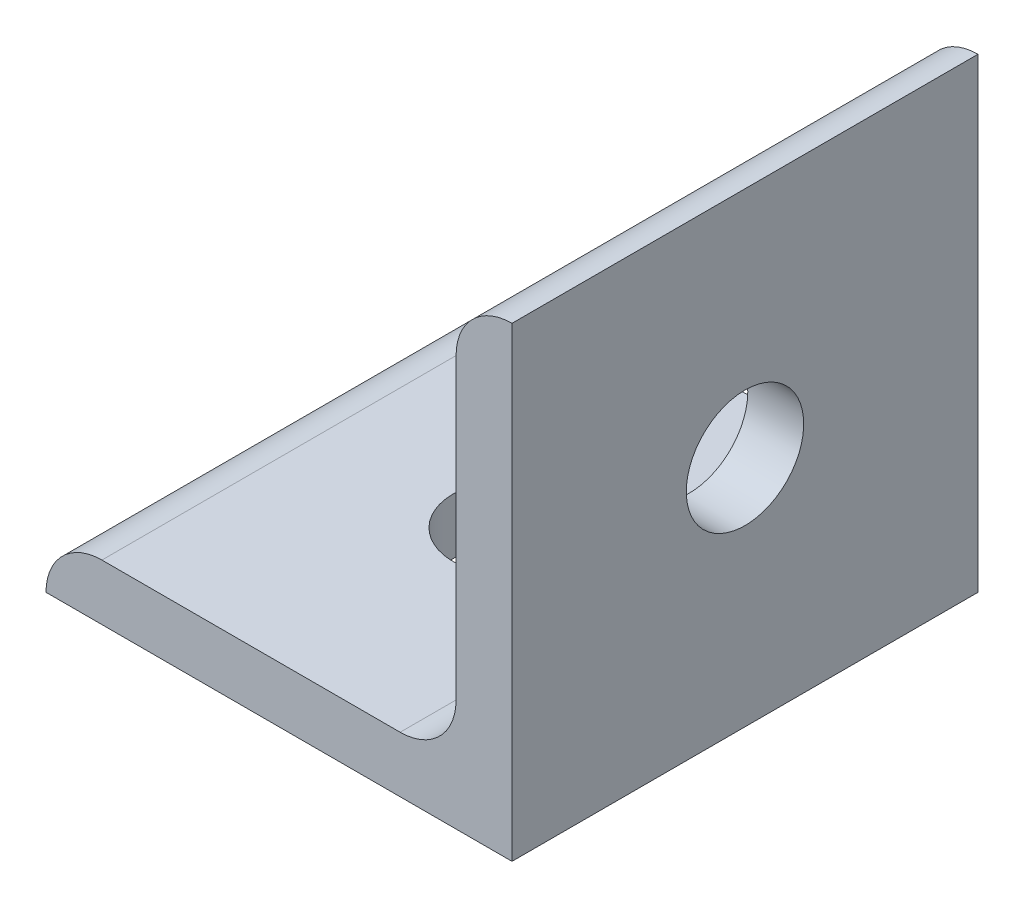
from build123d import *

# Parameters (mm, degrees)
EXTRUDE1_DEPTH     = 25
SKETCH2_R          = 3.15
CUT_EXTRUDE1_DEPTH = 25
SKETCH3_R          = 3.15
CUT_EXTRUDE2_DEPTH = 25


with BuildPart() as part:
    # Sketch1 → Extrude1 (new body)
    with BuildSketch(Plane.XY):
        with BuildLine():
            Line((22.39626556, -5.458921162), (22.39626556, -30.458921162))
            Line((22.39626556, -30.458921162), (-2.60373444, -30.458921162))
            ThreePointArc((-2.60373444, -30.458921162), (-1.725054783, -28.337600818), (0.39626556, -27.458921162))
            Line((0.39626556, -27.458921162), (16.39626556, -27.458921162))
            ThreePointArc((16.39626556, -27.458921162), (18.517585904, -26.580241505), (19.39626556, -24.458921162))
            Line((19.39626556, -24.458921162), (19.39626556, -8.458921162))
            ThreePointArc((19.39626556, -8.458921162), (20.274945217, -6.337600818), (22.39626556, -5.458921162))
        make_face()
    extrude(amount=EXTRUDE1_DEPTH)

    # Sketch2 → Cut-Extrude1 (cut)
    with BuildSketch(Plane(origin=(22.39626556, 0, 0), x_dir=(0, 0, -1), z_dir=(1, 0, 0))):
        with Locations(Location((-12.5, -17.958921162, 0), (0, 0, 90))):
            Circle(SKETCH2_R)
    extrude(amount=-CUT_EXTRUDE1_DEPTH, mode=Mode.SUBTRACT)

    # Sketch3 → Cut-Extrude2 (cut)
    with BuildSketch(Plane.XZ.offset(30.458921162)):
        with Locations(Location((9.89626556, 12.5, 0), (0, 0, 270))):
            Circle(SKETCH3_R)
    extrude(amount=-CUT_EXTRUDE2_DEPTH, mode=Mode.SUBTRACT)


solid = part.part
